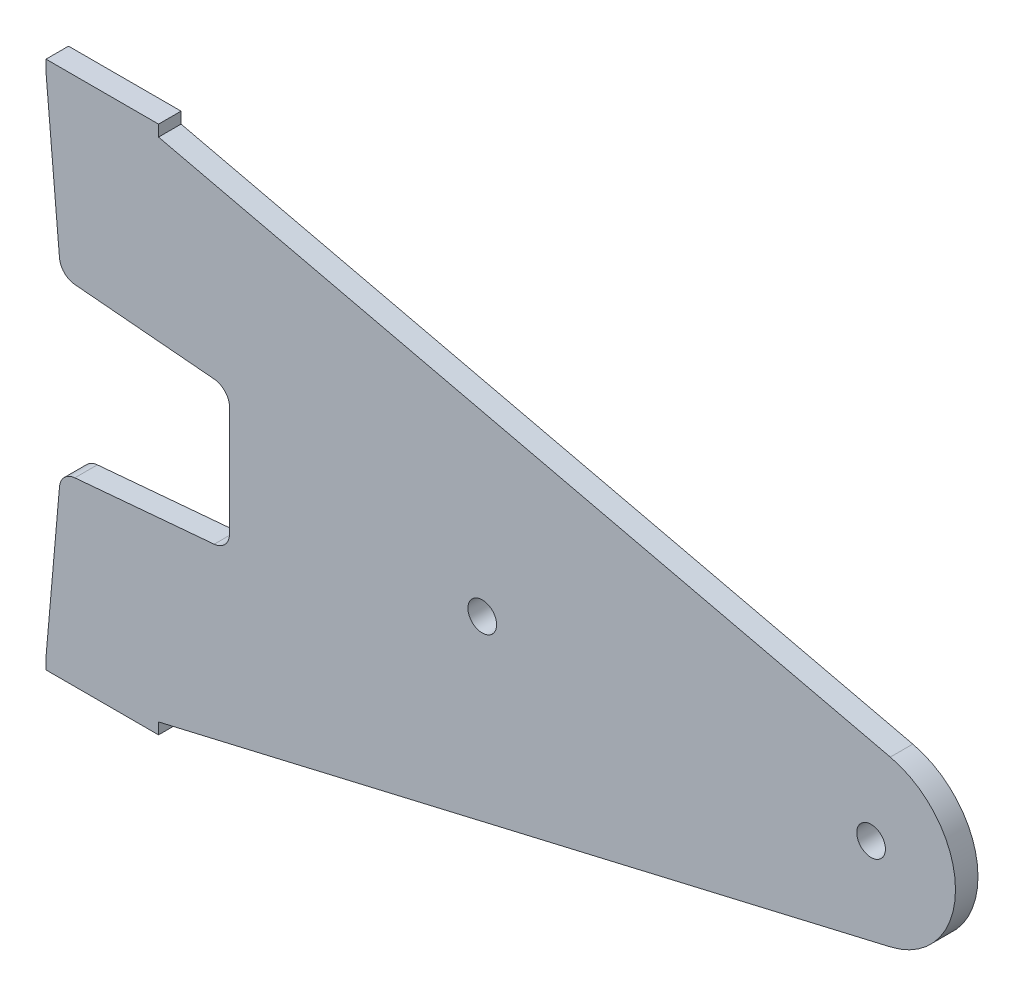
from build123d import *

# Parameters (mm, degrees)
SKETCH1_R           = 2.55
BOSS_EXTRUDE1_DEPTH = 4


with BuildPart() as part:
    # Sketch1 → Boss-Extrude1 (new body)
    with BuildSketch(Plane.XY):
        with BuildLine():
            Line((14.872885109, 17.599965411), (12.706250758, 42.361500851))
            Line((12.706250758, 42.361500851), (12.474619372, 45.008716695))
            Line((12.474619372, 45.008716695), (12.474619372, 47))
            Line((12.474619372, 47), (32.474619372, 47))
            Line((32.474619372, 47), (32.474619372, 45))
            Line((32.474619372, 45), (162.509181482, 14.606317485))
            ThreePointArc((162.509181482, 14.606317485), (174.095167783, 0), (162.509181482, -14.606317485))
            Line((162.509181482, -14.606317485), (32.474619372, -45))
            Line((32.474619372, -45), (32.474619372, -47))
            Line((32.474619372, -47), (12.474619372, -47))
            Line((12.474619372, -47), (12.474619372, -45.008716695))
            Line((12.474619372, -45.008716695), (12.706250758, -42.361500851))
            Line((12.706250758, -42.361500851), (14.872885109, -17.599965411))
            ThreePointArc((14.872885109, -17.599965411), (15.740145918, -15.740145918), (17.599965411, -14.872885109))
            Line((17.599965411, -14.872885109), (42.361500851, -12.706250758))
            ThreePointArc((42.361500851, -12.706250758), (44.311843411, -11.744427787), (45.1, -9.717669606))
            Line((45.1, -9.717669606), (45.1, 9.717669606))
            ThreePointArc((45.1, 9.717669606), (44.311843411, 11.744427787), (42.361500851, 12.706250758))
            Line((42.361500851, 12.706250758), (17.599965411, 14.872885109))
            ThreePointArc((17.599965411, 14.872885109), (15.740145918, 15.740145918), (14.872885109, 17.599965411))
        make_face()
        with Locations((159.095167783, 0)):
            Circle(SKETCH1_R, mode=Mode.SUBTRACT)
        with Locations((90, 0)):
            Circle(SKETCH1_R, mode=Mode.SUBTRACT)
    extrude(amount=BOSS_EXTRUDE1_DEPTH)


solid = part.part
